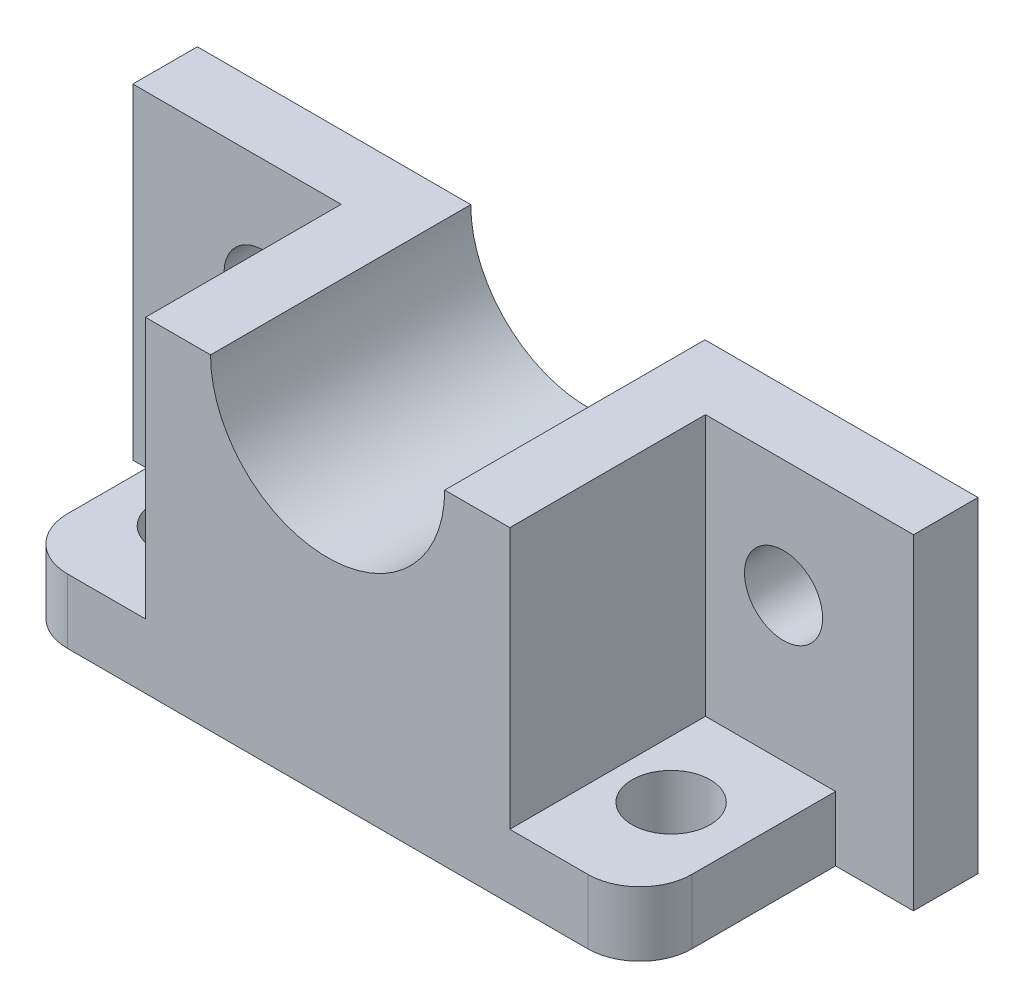
from build123d import *

# Parameters (mm, degrees)
BOSS_EXTRUDE1_DEPTH     = 15.748
BOSS_EXTRUDE3_DEPTH     = 47.752
SKETCH4_W               = 31.75
SKETCH4_H               = 47.752
BOSS_EXTRUDE4_DEPTH     = 15.748
FILLET1_R               = 12.7
CUT_EXTRUDE1_DEPTH      = 133.971969005
CUT_EXTRUDE1_DEPTH_BACK = 133.971969005
SKETCH5_R               = 9.525
CUT_EXTRUDE2_DEPTH      = 132.063135736
CUT_EXTRUDE2_DEPTH_BACK = 132.063135736
SKETCH6_R               = 9.525


with BuildPart() as part:
    # Sketch1 → Boss-Extrude1 (new body)
    with BuildSketch(Plane.XY):
        with BuildLine():
            Line((-28.575, 0), (-95.292827815, 0))
            Line((-95.292827815, 0), (-95.292827815, -79.502))
            Line((-95.292827815, -79.502), (95.207172185, -79.502))
            Line((95.207172185, -79.502), (95.207172185, 0))
            Line((95.207172185, 0), (28.575, 0))
            ThreePointArc((28.575, 0), (0, -28.575), (-28.575, 0))
        make_face()
    extrude(amount=BOSS_EXTRUDE1_DEPTH)

    # Sketch2 → Boss-Extrude3 (add)
    with BuildSketch(Plane.XY.offset(15.748)):
        with BuildLine():
            Line((-44.45, 0), (-44.45, -79.502))
            Line((-44.45, -79.502), (44.45, -79.502))
            Line((44.45, -79.502), (44.45, 0))
            Line((44.45, 0), (28.575, 0))
            ThreePointArc((28.575, 0), (0, -28.575), (-28.575, 0))
            Line((-28.575, 0), (-44.45, 0))
        make_face()
    extrude(amount=BOSS_EXTRUDE3_DEPTH)

    # Sketch4 → Boss-Extrude4 (add)
    with BuildSketch(Plane.XZ.offset(79.502)):
        with Locations((-60.325, 39.624)):
            Rectangle(SKETCH4_W, SKETCH4_H)
        with Locations((60.325, 39.624)):
            Rectangle(SKETCH4_W, SKETCH4_H)
    extrude(amount=-BOSS_EXTRUDE4_DEPTH)

    # Fillet1
    fillet1_edges = [part.edges().sort_by_distance(p)[0] for p in [
        (-76.2, -71.628, 63.5),
        (76.2, -71.628, 63.5),
    ]]
    fillet(fillet1_edges, radius=FILLET1_R)

    # Sketch5 → Cut-Extrude1 (cut, two sides: drawn at the far end of the back side and taken through both)
    with BuildSketch(Plane.XY.offset(15.748).offset(-CUT_EXTRUDE1_DEPTH_BACK)):
        with Locations((63.5, -28.702)):
            Circle(SKETCH5_R)
        with Locations((-63.5, -28.702)):
            Circle(SKETCH5_R)
    extrude(amount=CUT_EXTRUDE1_DEPTH + CUT_EXTRUDE1_DEPTH_BACK, mode=Mode.SUBTRACT)

    # Sketch6 → Cut-Extrude2 (cut, two sides: drawn at the far end of the back side and taken through both)
    with BuildSketch(Plane(origin=(0, -63.754, 0), x_dir=(1, 0, 0), z_dir=(0, 1, 0)).offset(-CUT_EXTRUDE2_DEPTH_BACK)):
        with Locations(Location((-58.42, -38.1, 0), (0, 0, 270))):
            Circle(SKETCH6_R)
        with Locations(Location((58.42, -38.1, 0), (0, 0, 270))):
            Circle(SKETCH6_R)
    extrude(amount=CUT_EXTRUDE2_DEPTH + CUT_EXTRUDE2_DEPTH_BACK, mode=Mode.SUBTRACT)


solid = part.part
